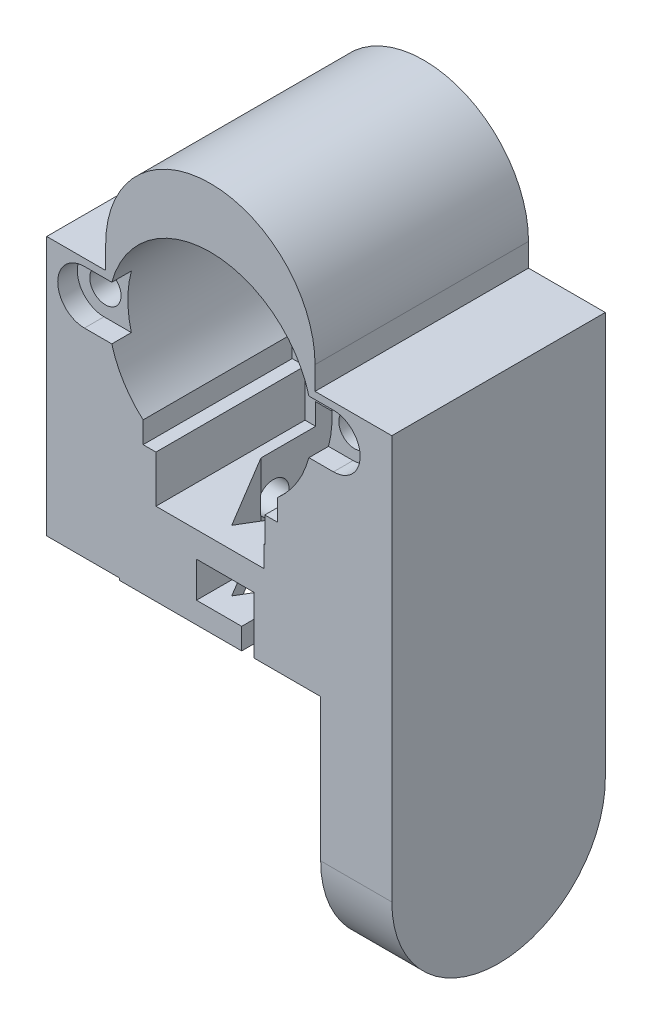
from build123d import *

# Parameters (mm, degrees)
BOSS_EXTRUDE1_DEPTH     = 20.95
BOSS_EXTRUDE2_START     = -9.05
BOSS_EXTRUDE2_DEPTH     = 9.05
SKETCH6_R               = 2.2
CUT_EXTRUDE2_DEPTH      = 10
CUT_EXTRUDE3_DEPTH      = 2.75
CUT_EXTRUDE4_DEPTH      = 67.499081444
CUT_EXTRUDE4_DEPTH_BACK = 67.499081444
SKETCH8_W               = 8.290514233
SKETCH8_H               = 3.25
SKETCH11_R              = 11.25
BEARING_HOLE_DEPTH      = 7.6
SKETCH9_W               = 12.3
SKETCH9_H               = 21.5
WIRE_HOLE_DEPTH         = 62.274898109
SKETCH12_W              = 46
SKETCH12_H              = 30
BOSS_EXTRUDE3_DEPTH     = 0.0001
BOSS_EXTRUDE4_DEPTH     = 7.5
BOSS_EXTRUDE5_START     = -7.5
BOSS_EXTRUDE5_DEPTH     = 7.5
BOSS_EXTRUDE9_START     = 2.5
BOSS_EXTRUDE9_DEPTH     = 2.5
SKETCH15_R              = 4
CUT_EXTRUDE5_DEPTH      = 77.054456365
SKETCH17_R              = 6.169612062
SHAT_HOLE_DEPTH         = 10
SKETCH18_R              = 4
BOSS_EXTRUDE7_DEPTH     = 14
SKETCH19_R              = 4.675
CUT_EXTRUDE6_DEPTH      = 2
SKETCH24_R              = 5
CUT_EXTRUDE7_DEPTH      = 65.382744838
FILLET1_R               = 1
SKETCH25_W              = 8.843315878
SKETCH25_H              = 4.834346013
BOSS_EXTRUDE10_DEPTH    = 2
SKETCH27_W              = 12.3
SKETCH27_H              = 21.5
CUT_EXTRUDE8_DEPTH      = 60.56786481
BOSS_EXTRUDE11_DEPTH    = 14.5901
CUT_EXTRUDE9_REACH      = 69.405
SKETCH29_W              = 15.2
SKETCH29_H              = 3
CUT_EXTRUDE14_START     = -10.25
CUT_EXTRUDE14_DEPTH     = 10.25
SKETCH34_R              = 6.901355235
CUT_EXTRUDE15_DEPTH     = 5
FILLET2_R               = 0.5
SKETCH35_R              = 2.2
CUT_EXTRUDE16_DEPTH     = 6.7
CUT_EXTRUDE17_DEPTH     = 10.25
CUT_EXTRUDE18_REACH     = 69.405


with BuildPart() as part:
    # Sketch2 → Boss-Extrude1 (new body)
    with BuildSketch(Plane.XY):
        with BuildLine():
            Line((-14.709485767, 40), (-23, 40))
            Line((-23, 40), (-23, 0))
            Line((-23, 0), (23, 0))
            Line((23, 0), (23, 40))
            Line((23, 40), (14.709485767, 40))
            ThreePointArc((14.709485767, 40), (0, 54.709485767), (-14.709485767, 40))
        make_face()
        with BuildLine():
            Line((-7.65, 18.18111404), (-7.65, 14.59))
            Line((-7.65, 14.59), (7.65, 14.59))
            Line((7.65, 14.59), (7.65, 18.18111404))
            Line((7.65, 18.18111404), (9.45, 18.18111404))
            Line((9.45, 18.18111404), (9.45, 21.20025831))
            ThreePointArc((9.45, 21.20025831), (0, 46.349332344), (-9.45, 21.20025831))
            Line((-9.45, 21.20025831), (-9.45, 18.18111404))
            Line((-9.45, 18.18111404), (-7.65, 18.18111404))
        make_face(mode=Mode.SUBTRACT)
    extrude(amount=BOSS_EXTRUDE1_DEPTH)

    # Sketch3 → Boss-Extrude2 (add)
    with BuildSketch(Plane.XY.offset(BOSS_EXTRUDE2_START)):
        with BuildLine():
            Line((-14.709485767, 40), (-23, 40))
            Line((-23, 40), (-23, 0))
            Line((-23, 0), (23, 0))
            Line((23, 0), (23, 40))
            Line((23, 40), (14.709485767, 40))
            ThreePointArc((14.709485767, 40), (0, 54.709485767), (-14.709485767, 40))
        make_face()
    extrude(amount=BOSS_EXTRUDE2_DEPTH)

    # Sketch6 → Cut-Extrude2 (cut)
    with BuildSketch(Plane.XY.offset(20.95)):
        with Locations((-17.5, 32)):
            Circle(SKETCH6_R)
        with Locations((17.5, 32)):
            Circle(SKETCH6_R)
    extrude(amount=-CUT_EXTRUDE2_DEPTH, mode=Mode.SUBTRACT)

    # Sketch7 → Cut-Extrude3 (cut)
    with BuildSketch(Plane.XY.offset(20.95)):
        with BuildLine():
            Line((-17.7, 35.75), (17.3, 35.75))
            ThreePointArc((17.3, 35.75), (21.05, 32), (17.3, 28.25))
            Line((17.3, 28.25), (-17.7, 28.25))
            ThreePointArc((-17.7, 28.25), (-21.45, 32), (-17.7, 35.75))
        make_face()
    extrude(amount=-CUT_EXTRUDE3_DEPTH, mode=Mode.SUBTRACT)

    # Sketch8 → Cut-Extrude4 (cut, two sides: drawn at the far end of the back side and taken through both)
    with BuildSketch(Plane.XY.offset(20.95).offset(-CUT_EXTRUDE4_DEPTH_BACK)):
        with Locations((-18.854742884, 38.375)):
            Rectangle(SKETCH8_W, SKETCH8_H)
        with Locations((18.854742884, 38.375)):
            Rectangle(SKETCH8_W, SKETCH8_H)
    extrude(amount=CUT_EXTRUDE4_DEPTH + CUT_EXTRUDE4_DEPTH_BACK, mode=Mode.SUBTRACT)

    # Sketch11 → Bearing Hole (cut)
    with BuildSketch(Plane(origin=(0, 0, -9.05), x_dir=(-1, 0, 0), z_dir=(0, 0, -1))):
        with Locations((0, 40)):
            Circle(SKETCH11_R)
    extrude(amount=-BEARING_HOLE_DEPTH, mode=Mode.SUBTRACT)

    # Sketch9 → Wire Hole (cut, through all)
    with BuildSketch(Plane(origin=(0, 14.59, -19.25), x_dir=(-1, 0, 0), z_dir=(0, 1, 0))):
        with Locations((0, 26.95)):
            Rectangle(SKETCH9_W, SKETCH9_H)
    extrude(amount=-WIRE_HOLE_DEPTH, mode=Mode.SUBTRACT)

    # Sketch12 → Boss-Extrude3 (add)
    with BuildSketch(Plane.XZ):
        with Locations((0, 5.95)):
            Rectangle(SKETCH12_W, SKETCH12_H)
    extrude(amount=BOSS_EXTRUDE3_DEPTH)

    # Sketch13 → Boss-Extrude4 (add)
    with BuildSketch(Plane(origin=(23, 0, 0), x_dir=(0, 0, -1), z_dir=(1, 0, 0))):
        with BuildLine():
            Line((-20.95, -0.0001), (-20.95, -20.0001))
            ThreePointArc((-20.95, -20.0001), (-5.95, -35.0001), (9.05, -20.0001))
            Line((9.05, -20.0001), (9.05, -0.0001))
            Line((9.05, -0.0001), (-20.95, -0.0001))
        make_face()
    extrude(amount=-BOSS_EXTRUDE4_DEPTH)

    # Sketch14 → Boss-Extrude5 (add)
    with BuildSketch(Plane.ZY.offset(23).offset(BOSS_EXTRUDE5_START)):
        with BuildLine():
            Line((-9.05, -20.0001), (-9.05, -0.0001))
            Line((-9.05, -0.0001), (20.95, -0.0001))
            Line((20.95, -0.0001), (20.95, -20.0001))
            ThreePointArc((20.95, -20.0001), (5.95, -35.0001), (-9.05, -20.0001))
        make_face()
    extrude(amount=BOSS_EXTRUDE5_DEPTH)

    # Sketch21 → Boss-Extrude9 (add)
    with BuildSketch(Plane(origin=(23, 0, 0), x_dir=(0, 0, -1), z_dir=(1, 0, 0)).offset(BOSS_EXTRUDE9_START)):
        with BuildLine():
            Line((-20.95, -20.0001), (-20.95, 36.75))
            Line((-20.95, 36.75), (9.05, 36.75))
            Line((9.05, 36.75), (9.05, -20.0001))
            ThreePointArc((9.05, -20.0001), (-5.95, -35.0001), (-20.95, -20.0001))
        make_face()
    extrude(amount=-BOSS_EXTRUDE9_DEPTH)

    # Sketch15 → Cut-Extrude5 (cut, through all)
    with BuildSketch(Plane.ZY.offset(23)):
        with Locations(Location((5.95, -20.0001, 0), (0, 0, 270))):
            Circle(SKETCH15_R)
    extrude(amount=-CUT_EXTRUDE5_DEPTH, mode=Mode.SUBTRACT)

    # Sketch17 → Shat hole (add)
    with BuildSketch(Plane(origin=(25.5, 0, -23), x_dir=(0, 0, 1), z_dir=(-1, 0, 0))):
        with Locations((28.95, -20.0001)):
            Circle(SKETCH17_R)
        with BuildLine():
            Line((26.876355865, -18.3501), (31.023644135, -18.3501))
            ThreePointArc((31.023644135, -18.3501), (31.6, -20.0001), (31.023644135, -21.6501))
            Line((31.023644135, -21.6501), (26.876355865, -21.6501))
            ThreePointArc((26.876355865, -21.6501), (26.3, -20.0001), (26.876355865, -18.3501))
        make_face(mode=Mode.SUBTRACT)
    extrude(amount=SHAT_HOLE_DEPTH)

    # Sketch18 → Boss-Extrude7 (add)
    with BuildSketch(Plane.ZY.offset(23)):
        with Locations(Location((5.95, -20.0001, 0), (0, 0, 270))):
            Circle(SKETCH18_R)
    extrude(amount=-BOSS_EXTRUDE7_DEPTH)

    # Sketch19 → Cut-Extrude6 (cut)
    with BuildSketch(Plane.ZY.offset(-15.5)):
        with Locations((5.95, -20.0001)):
            Circle(SKETCH19_R)
    extrude(amount=-CUT_EXTRUDE6_DEPTH, mode=Mode.SUBTRACT)

    # Sketch24 → Cut-Extrude7 (cut, through all)
    with BuildSketch(Plane(origin=(0, 0, -1.45), x_dir=(-1, 0, 0), z_dir=(0, 0, -1))):
        with Locations((0, 40)):
            Circle(SKETCH24_R)
    extrude(amount=-CUT_EXTRUDE7_DEPTH, mode=Mode.SUBTRACT)

    # Fillet1
    fillet1_edges = [part.edges().sort_by_distance(p)[0] for p in [
        (11.25, 40, -9.05),
    ]]
    fillet(fillet1_edges, radius=FILLET1_R)

    # Sketch25 → Boss-Extrude10 (add)
    with BuildSketch(Plane(origin=(25.5, 0, 0), x_dir=(0, 0, -1), z_dir=(1, 0, 0))):
        with Locations((-6.185865257, -20.38943492)):
            Rectangle(SKETCH25_W, SKETCH25_H)
    extrude(amount=-BOSS_EXTRUDE10_DEPTH)

    # Sketch27 → Cut-Extrude8 (cut, through all)
    with BuildSketch(Plane(origin=(0, 14.59, 0), x_dir=(1, 0, 0), z_dir=(0, 1, 0))):
        with Locations((0, -7.7)):
            Rectangle(SKETCH27_W, SKETCH27_H)
    extrude(amount=-CUT_EXTRUDE8_DEPTH, mode=Mode.SUBTRACT)

    # Sketch28 → Boss-Extrude11 (add)
    with BuildSketch(Plane.XZ.offset(0.0001)):
        Polygon((-6.15, 7.7), (0, 17.95), (6.15, 7.7), (6.15, 18.45), (-6.15, 18.45), align=None)
    extrude(amount=-BOSS_EXTRUDE11_DEPTH)

    # Cut-Extrude9: up to this face of the body (flat: up to its plane)
    cut_extrude9_end = Plane(part.part.faces().sort_by_distance((0, 29.436315862, 0))[0])
    # Sketch29 → Cut-Extrude9 (cut, up to the picked face)
    with BuildSketch(Plane.XY.offset(20.95), mode=Mode.PRIVATE) as cut_extrude9_sk1:
        with Locations((-0.05, 13.09)):
            Rectangle(SKETCH29_W, SKETCH29_H)
    cut_extrude9_tool1 = split(extrude(cut_extrude9_sk1.sketch, amount=-CUT_EXTRUDE9_REACH, mode=Mode.PRIVATE), bisect_by=cut_extrude9_end, keep=Keep.BOTH, mode=Mode.PRIVATE)
    add(cut_extrude9_tool1.solids().sort_by(Axis((-0.05, 13.09, 20.95), (0, 0, -1)))[0], mode=Mode.SUBTRACT)

    # Sketch33 → Cut-Extrude14 (cut)
    with BuildSketch(Plane.ZY.offset(23).offset(CUT_EXTRUDE14_START)):
        with BuildLine():
            Line((-4.35, 11.89), (16.25, 11.89))
            Line((16.25, 11.89), (11.25, 0.2999))
            Line((11.25, 0.2999), (20.95, 0.2999))
            Line((20.95, 0.2999), (20.95, -20.0001))
            ThreePointArc((20.95, -20.0001), (5.95, -35.0001), (-9.05, -20.0001))
            Line((-9.05, -20.0001), (-9.05, 0.2999))
            Line((-9.05, 0.2999), (0.65, 0.2999))
            Line((0.65, 0.2999), (-4.35, 11.89))
        make_face()
    extrude(amount=CUT_EXTRUDE14_DEPTH, mode=Mode.SUBTRACT)


with BuildPart() as cut_extrude14_piece_1:
    # of the separate pieces the step leaves, piece 1, a body of its own (cut_extrude14_pieces)
    add(part.part.solids().sort_by_distance((14.709485767, 40, -9.05))[0])

    # Fillet2
    fillet2_edges = [cut_extrude14_piece_1.edges().sort_by_distance(p)[0] for p in [
        (-17.875, 0.2999, 11.25),
        (-17.875, 0.2999, 0.65),
    ]]
    fillet(fillet2_edges, radius=FILLET2_R)

    # Sketch35 → Cut-Extrude16 (cut)
    with BuildSketch(Plane.ZY.offset(12.75)):
        with Locations(Location((5.95, 5.89, 0), (0, 0, 270))):
            Circle(SKETCH35_R)
    extrude(amount=-CUT_EXTRUDE16_DEPTH, mode=Mode.SUBTRACT)

    # Sketch36 → Cut-Extrude17 (cut)
    with BuildSketch(Plane.ZY.offset(23)):
        with BuildLine():
            Line((-3.953885576, 10.971798844), (-4.35, 11.89))
            Line((-4.35, 11.89), (-3.35, 11.89))
            ThreePointArc((-3.35, 11.89), (-5.185498182, 12.43949321), (-3.953885576, 10.971798844))
        make_face()
        with BuildLine():
            Line((15.853885576, 10.971798844), (16.25, 11.89))
            Line((16.25, 11.89), (15.25, 11.89))
            ThreePointArc((15.25, 11.89), (17.085498182, 12.43949321), (15.853885576, 10.971798844))
        make_face()
    extrude(amount=-CUT_EXTRUDE17_DEPTH, mode=Mode.SUBTRACT)

    # Sketch37 → Cut-Extrude18 (cut, up to next)
    with BuildSketch(Plane.XY.offset(20.95), mode=Mode.PRIVATE) as cut_extrude18_sk1:
        Polygon((6.15, -0.0001), (6.15, 7.9999), (-1.95, 7.9999), (-1.95, 2.9999), (4.4, 2.9999), (4.4, -0.0001), align=None)
    cut_extrude18_tool1 = extrude(cut_extrude18_sk1.sketch, amount=-CUT_EXTRUDE18_REACH, mode=Mode.PRIVATE) & cut_extrude14_piece_1.part
    add(cut_extrude18_tool1.solids().sort_by_distance((2.464344, 5.040884, 20.95))[0], mode=Mode.SUBTRACT)


with BuildPart() as cut_extrude14_piece_2:
    # of the separate pieces the step leaves, piece 2, a body of its own (cut_extrude14_pieces)
    add(part.part.solids().sort_by_distance((-12.75, -24.0001, 5.95))[0])

    # Sketch34 → Cut-Extrude15 (cut)
    with BuildSketch(Plane.ZY.offset(12.75)):
        with Locations((5.95, -20.0001)):
            Circle(SKETCH34_R)
    extrude(amount=-CUT_EXTRUDE15_DEPTH, mode=Mode.SUBTRACT)


solid = cut_extrude14_piece_1.part
